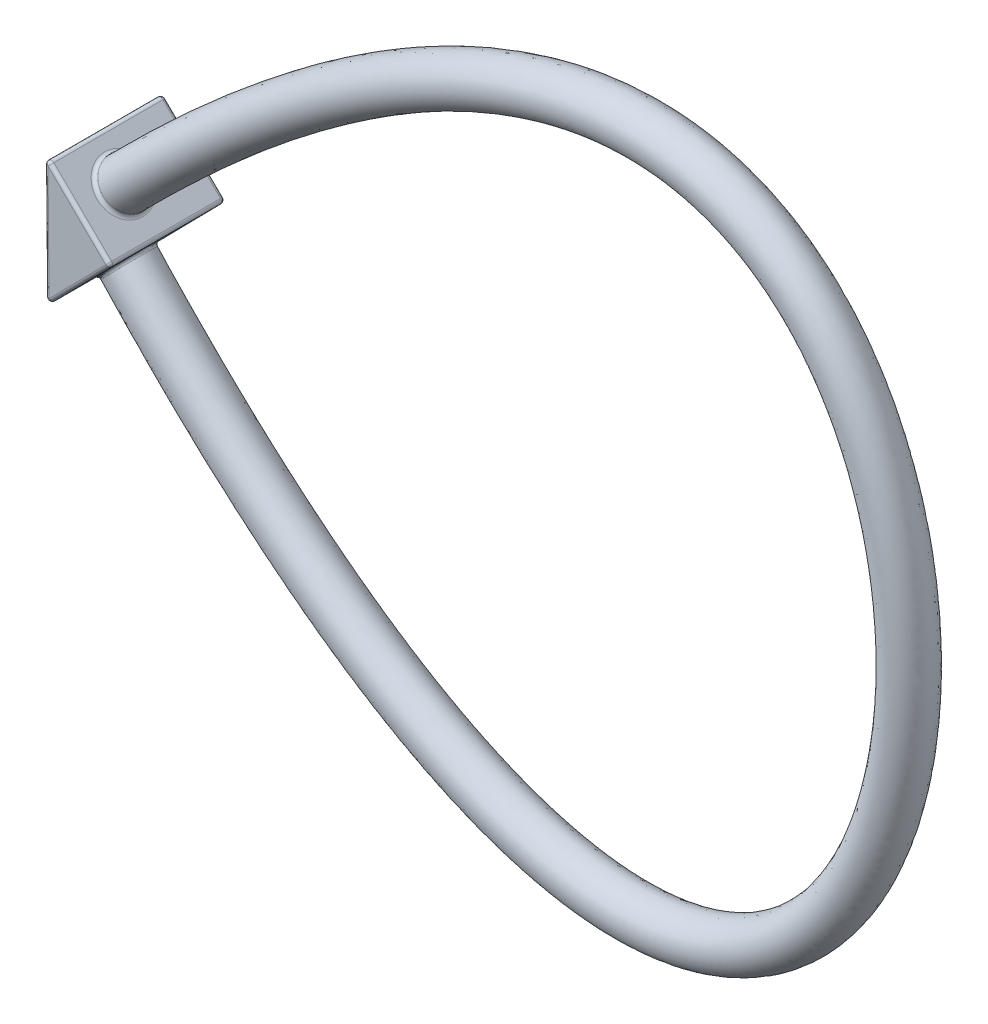
from build123d import *

# Parameters (mm, degrees)
SKETCH2_R           = 1
SKETCH3_W           = 4
SKETCH3_H           = 5
BOSS_EXTRUDE1_DEPTH = 4
CUT_EXTRUDE1_DEPTH  = 40.207148558
FILLET1_R           = 0.15


with BuildPart() as part:
    # Sweep1: sweep along a path in Sketch1
    with BuildLine() as sweep1_path:  # in the path sketch's own coordinates; laid on its plane below (add() does not lay a ready-made edge on the line's plane)
        add(Edge.make_bspline(
            [(0, 0), (46.375630859, 47.22581785), (43.968499802, -50.489782118), (0, -2.57438814)],
            knots=[0, 0, 0, 0, 1, 1, 1, 1], degree=3))
    # Sketch2 → Sweep1 (sweep)
    with BuildSketch(Plane(origin=(0, 0, 0), x_dir=(0.7135000381640686, -0.7006551901897771, 0), z_dir=(0.7006551901897771, 0.7135000381640686, 0))):
        Circle(SKETCH2_R)
    sweep(path=Plane.XY * sweep1_path.line)

    # Sketch3 → Boss-Extrude1 (add)
    with BuildSketch(Plane(origin=(0, 0, 0), x_dir=(0.7135000381640686, -0.7006551901897771, 0), z_dir=(-0.7006551901897771, -0.7135000381640686, 0))):
        with Locations((0, -0.5)):
            Rectangle(SKETCH3_W, SKETCH3_H)
    extrude(amount=BOSS_EXTRUDE1_DEPTH)

    # Sketch4 → Cut-Extrude1 (cut, through all)
    with BuildSketch(Plane.XY.offset(2)):
        Polygon((-1.375620684, -4.255310533), (-1.427000076, 1.40131038), (-7.009211047, 1.350606858), (-6.957831655, -4.306014055), align=None)
    extrude(amount=-CUT_EXTRUDE1_DEPTH, mode=Mode.SUBTRACT)

    # Fillet1
    fillet1_edges = [part.edges().sort_by_distance(p)[0] for p in [
        (-1.40131038, -1.427000076, 2),
        (-1.40131038, -1.427000076, -3),
        (-0.568513317, -3.433406769, 0),
        (-1.427000076, 1.40131038, -0.5),
        (0, 0, -3),
        (1.427000076, -1.40131038, -0.5),
        (0.025689696, -2.828310457, -3),
        (0, 0, 2),
        (0.025689696, -2.828310457, 2),
        (-1.375620684, -4.255310533, -0.5),
        (-0.7135000381640703, 0.7006551901897754, 1.6690853266252912e-11),
    ]]
    fillet(fillet1_edges, radius=FILLET1_R)


solid = part.part
